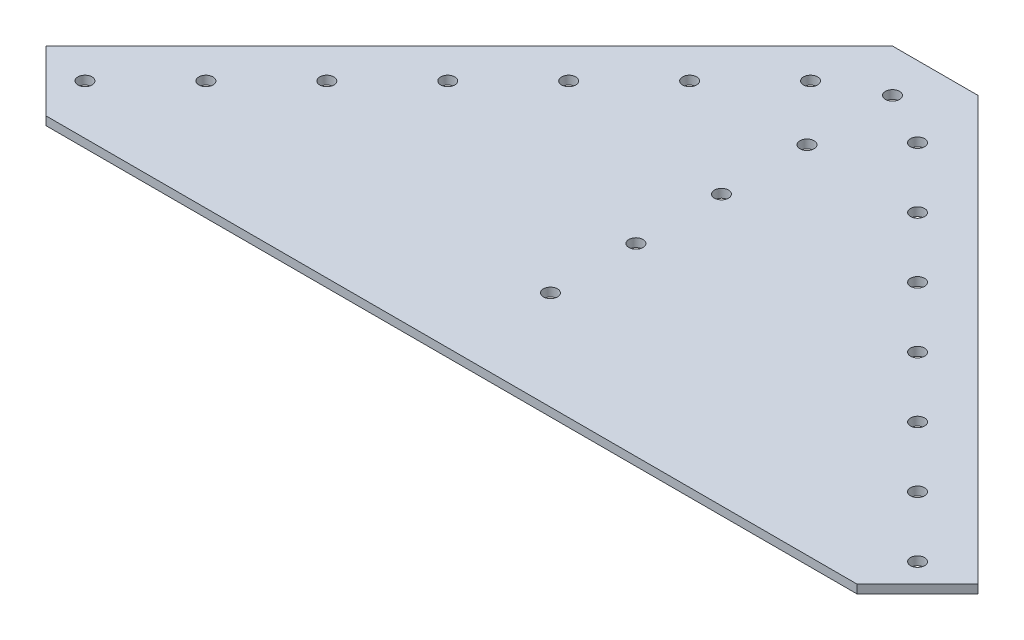
from build123d import *

# Parameters (mm, degrees)
BOSS_EXTRUDE1_DEPTH        = 2.54
CUT_EXTRUDE1_DEPTH         = 209.542345228
CUT_EXTRUDE1_DEPTH_BACK    = 209.542345228
SKETCH2_R                  = 2.0955
F_8_0_199_DIAMETER_HOLE1_D = 4.191


with BuildPart() as part:
    # Sketch1 → Boss-Extrude1 (new body)
    with BuildSketch(Plane(origin=(0, 0, 0), x_dir=(1, 0, 0), z_dir=(0, 1, 0))):
        Polygon((0, 0), (25.4, 0), (151.123585695, -125.723585695), (133.163073453, -143.684097937), (-107.763073453, -143.684097937), (-125.723585695, -125.723585695), align=None)
    extrude(amount=BOSS_EXTRUDE1_DEPTH)

    # Sketch2 → Cut-Extrude1 (cut, two sides: drawn at the far end of the back side and taken through both)
    with BuildSketch(Plane(origin=(0, 2.54, 0), x_dir=(1, 0, 0), z_dir=(0, 1, 0)).offset(-CUT_EXTRUDE1_DEPTH_BACK)):
        with Locations(Location((12.7, -12.7, 0), (0, 0, 270))):
            Circle(SKETCH2_R)
        with Locations(Location((12.7, -38.1, 0), (0, 0, 270))):
            Circle(SKETCH2_R)
        with Locations(Location((12.7, -63.5, 0), (0, 0, 270))):
            Circle(SKETCH2_R)
        with Locations(Location((12.7, -88.9, 0), (0, 0, 270))):
            Circle(SKETCH2_R)
        with Locations(Location((12.7, -114.3, 0), (0, 0, 270))):
            Circle(SKETCH2_R)
    extrude(amount=CUT_EXTRUDE1_DEPTH + CUT_EXTRUDE1_DEPTH_BACK, mode=Mode.SUBTRACT)

    # #8 (0.199) Diameter Hole1 (through all)
    with Locations(Plane(origin=(0, 0, 0), x_dir=(-1, 0, 0), z_dir=(0, -1, 0))):
        with Locations((21.151548005, -39.112060247), (39.112060247, -57.072572489), (57.072572489, -75.033084731), (75.033084731, -92.993596973), (92.993596973, -110.954109215), (110.954109215, -128.914621458), (-28.591035763, -21.151548005), (-46.551548005, -39.112060247), (-64.512060247, -57.072572489), (-82.472572489, -75.033084731), (-100.433084731, -92.993596973), (-118.393596973, -110.954109215), (-136.354109215, -128.914621458), (3.191035763, -21.151548005)):
            Hole(F_8_0_199_DIAMETER_HOLE1_D / 2)


solid = part.part
